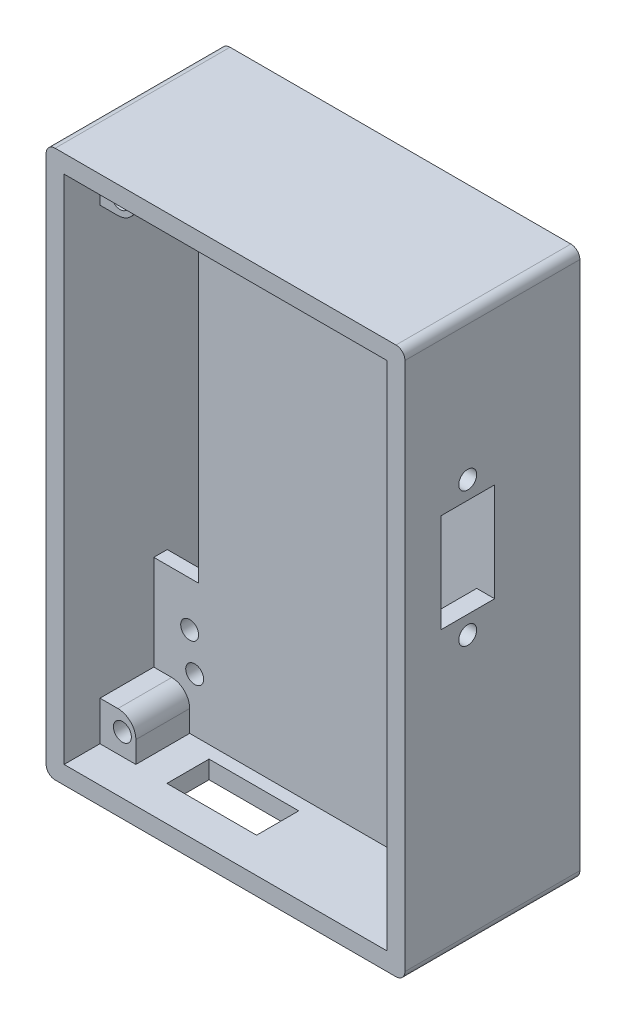
from build123d import *

# Parameters (mm, degrees)
SKETCH_2_R             = 1
EXTRUDE_2250_DEPTH     = 7.5
EXTRUDE_2250_2_DEPTH   = 7.5
EXTRUDE_2250_3_DEPTH   = 7.5
EXTRUDE_2250_4_DEPTH   = 7.5
EXTRUDE_START          = -4.5
SKETCH_2_5_R           = 1
EXTRUDE_2650_DEPTH     = 4.5
EXTRUDE_2650_2_DEPTH   = 4.5
EXTRUDE_2650_3_DEPTH   = 4.5
EXTRUDE_2650_4_DEPTH   = 4.5
EXTRUDE_2769_DEPTH     = 11.5
SKETCH_15_W            = 10
SKETCH_15_H            = 4.7
CUT_EXTRUDE_2936_DEPTH = 2
ESP32_START            = -8
ESP32_DEPTH            = 8
ESP32_3_W              = 10
ESP32_3_H              = 4.7
ESP32_2_DEPTH          = 2
SKETCH_1_29_R          = 1
SKETCH_1_29_W          = 1.5
SKETCH_1_29_H          = 9
EXTRUDE_3195_DEPTH     = 1.5
EXTRUDE_3_DEPTH        = 2.5
SKETCH_1_30_W          = 1.5
SKETCH_1_30_H          = 9
EXTRUDE_3_2_DEPTH      = 2.5
SKETCH_1_31_W          = 1.5
SKETCH_1_31_H          = 9
EXTRUDE_4_DEPTH        = 1.5
SKETCH_18_R            = 1
SKETCH_18_W            = 6
SKETCH_18_H            = 11
CUT_EXTRUDE_4645_DEPTH = 2


with BuildPart() as part:
    # 草图2 → Extrude 2250 (new body)
    with BuildSketch(Plane.XY):
        with BuildLine():
            Line((0, 0), (4, 0))
            Line((4, 0), (4, 2.4))
            ThreePointArc((4, 2.4), (3.414213562, 3.814213562), (2, 4.4))
            Line((2, 4.4), (0, 4.4))
            Line((0, 4.4), (0, 0))
        make_face()
        with Locations((2.5, 2.4)):
            Circle(SKETCH_2_R, mode=Mode.SUBTRACT)
    extrude(amount=EXTRUDE_2250_DEPTH)



with BuildPart() as body_2:
    # 草图2 → Extrude 2250 2 (new body)
    with BuildSketch(Plane.XY):
        with BuildLine():
            Line((36, 0), (32, 0))
            Line((32, 0), (32, 2.4))
            ThreePointArc((32, 2.4), (32.585786438, 3.814213562), (34, 4.4))
            Line((34, 4.4), (36, 4.4))
            Line((36, 4.4), (36, 0))
        make_face()
        with Locations((34, 2.4)):
            Circle(SKETCH_2_R, mode=Mode.SUBTRACT)
    extrude(amount=EXTRUDE_2250_2_DEPTH)


with BuildPart() as body_3:
    # 草图2 → Extrude 2250 3 (new body)
    with BuildSketch(Plane.XY):
        with BuildLine():
            Line((36, 57), (32, 57))
            Line((32, 57), (32, 54))
            ThreePointArc((32, 54), (32.585786438, 52.585786438), (34, 52))
            Line((34, 52), (36, 52))
            Line((36, 52), (36, 57))
        make_face()
        with Locations((33.75, 53.699390835)):
            Circle(SKETCH_2_R, mode=Mode.SUBTRACT)
    extrude(amount=EXTRUDE_2250_3_DEPTH)


with BuildPart() as body_4:
    # 草图2 → Extrude 2250 4 (new body)
    with BuildSketch(Plane.XY):
        with BuildLine():
            Line((0, 57), (4, 57))
            Line((4, 57), (4, 54))
            ThreePointArc((4, 54), (3.414213562, 52.585786438), (2, 52))
            Line((2, 52), (0, 52))
            Line((0, 52), (0, 57))
        make_face()
        with Locations((2.25, 53.699390835)):
            Circle(SKETCH_2_R, mode=Mode.SUBTRACT)
    extrude(amount=EXTRUDE_2250_4_DEPTH)


with BuildPart() as body_5:
    # 草图2<5> → Extrude 2650 (new body)
    with BuildSketch(Plane.XY.offset(EXTRUDE_START)):
        with BuildLine():
            Line((0, 0), (4, 0))
            Line((4, 0), (4, 2.4))
            ThreePointArc((4, 2.4), (3.414213562, 3.814213562), (2, 4.4))
            Line((2, 4.4), (0, 4.4))
            Line((0, 4.4), (0, 0))
        make_face()
        with Locations((2.5, 2.4)):
            Circle(SKETCH_2_5_R, mode=Mode.SUBTRACT)
    extrude(amount=EXTRUDE_2650_DEPTH)


with BuildPart() as body_6:
    # 草图2<5> → Extrude 2650 2 (new body)
    with BuildSketch(Plane.XY.offset(EXTRUDE_START)):
        with BuildLine():
            Line((36, 0), (32, 0))
            Line((32, 0), (32, 2.4))
            ThreePointArc((32, 2.4), (32.585786438, 3.814213562), (34, 4.4))
            Line((34, 4.4), (36, 4.4))
            Line((36, 4.4), (36, 0))
        make_face()
        with Locations((34, 2.4)):
            Circle(SKETCH_2_5_R, mode=Mode.SUBTRACT)
    extrude(amount=EXTRUDE_2650_2_DEPTH)


with BuildPart() as body_7:
    # 草图2<5> → Extrude 2650 3 (new body)
    with BuildSketch(Plane.XY.offset(EXTRUDE_START)):
        with BuildLine():
            Line((36, 57), (32, 57))
            Line((32, 57), (32, 54))
            ThreePointArc((32, 54), (32.585786438, 52.585786438), (34, 52))
            Line((34, 52), (36, 52))
            Line((36, 52), (36, 57))
        make_face()
        with Locations((33.75, 53.699390835)):
            Circle(SKETCH_2_5_R, mode=Mode.SUBTRACT)
    extrude(amount=EXTRUDE_2650_3_DEPTH)


with BuildPart() as body_8:
    # 草图2<5> → Extrude 2650 4 (new body)
    with BuildSketch(Plane.XY.offset(EXTRUDE_START)):
        with BuildLine():
            Line((0, 57), (4, 57))
            Line((4, 57), (4, 54))
            ThreePointArc((4, 54), (3.414213562, 52.585786438), (2, 52))
            Line((2, 52), (0, 52))
            Line((0, 52), (0, 57))
        make_face()
        with Locations((2.25, 53.699390835)):
            Circle(SKETCH_2_5_R, mode=Mode.SUBTRACT)
    extrude(amount=EXTRUDE_2650_4_DEPTH)


with BuildPart() as part_1:
    add(part.part)

    add(body_2.part)  # Extrude 2769 merges body 2

    add(body_3.part)  # Extrude 2769 merges body 3

    add(body_4.part)  # Extrude 2769 merges body 4

    add(body_5.part)  # Extrude 2769 merges body 5

    add(body_6.part)  # Extrude 2769 merges body 6

    add(body_7.part)  # Extrude 2769 merges body 7

    add(body_8.part)  # Extrude 2769 merges body 8
    # 草图1 → Extrude 2769 (add)
    with BuildSketch(Plane.XY):
        with BuildLine():
            ThreePointArc((-2, -1), (-1.707106781, -1.707106781), (-1, -2))
            Line((-1, -2), (37, -2))
            ThreePointArc((37, -2), (37.707106781, -1.707106781), (38, -1))
            Line((38, -1), (38, 58))
            ThreePointArc((38, 58), (37.707106781, 58.707106781), (37, 59))
            Line((37, 59), (-1, 59))
            ThreePointArc((-1, 59), (-1.707106781, 58.707106781), (-2, 58))
            Line((-2, 58), (-2, -1))
        make_face()
        Polygon((36, 0), (0, 0), (0, 15), (0, 51), (0, 57), (36, 57), align=None, mode=Mode.SUBTRACT)
    extrude(amount=EXTRUDE_2769_DEPTH)

    # 草图15 → Cut-Extrude 2936 (cut)
    with BuildSketch(Plane.XZ):
        with Locations((12.56, 5.25)):
            Rectangle(SKETCH_15_W, SKETCH_15_H)
    extrude(amount=CUT_EXTRUDE_2936_DEPTH, mode=Mode.SUBTRACT)

    # 草图1 regions → ESP32 (add)
    with BuildSketch(Plane.XY.offset(ESP32_START)):
        with BuildLine():
            ThreePointArc((-2, -1), (-1.707106781, -1.707106781), (-1, -2))
            Line((-1, -2), (37, -2))
            ThreePointArc((37, -2), (37.707106781, -1.707106781), (38, -1))
            Line((38, -1), (38, 58))
            ThreePointArc((38, 58), (37.707106781, 58.707106781), (37, 59))
            Line((37, 59), (-1, 59))
            ThreePointArc((-1, 59), (-1.707106781, 58.707106781), (-2, 58))
            Line((-2, 58), (-2, -1))
        make_face()
        Polygon((36, 0), (0, 0), (0, 15), (0, 51), (0, 57), (36, 57), align=None, mode=Mode.SUBTRACT)
    extrude(amount=ESP32_DEPTH)

    # ESP32 3 → ESP32 2 (cut)
    with BuildSketch(Plane(origin=(0, 0, 0), x_dir=(1, 0, 0), z_dir=(0, 1, 0))):
        with Locations((17.56, 2.35)):
            Rectangle(ESP32_3_W, ESP32_3_H)
    extrude(amount=-ESP32_2_DEPTH, mode=Mode.SUBTRACT)

    # 草图1<29> → Extrude 3195 (add)
    with BuildSketch(Plane.XY):
        Polygon((0, 15), (0, 0), (36, 0), (36, 57), (0, 57), (0, 51), (5, 51), (5, 15), align=None)
        with Locations((4.56, 6)):
            Circle(SKETCH_1_29_R, mode=Mode.SUBTRACT)
        with Locations((4, 10)):
            Circle(SKETCH_1_29_R, mode=Mode.SUBTRACT)
        with Locations((6.5, 20.5)):
            Rectangle(SKETCH_1_29_W, SKETCH_1_29_H, mode=Mode.SUBTRACT)
        with Locations((30.56, 6)):
            Circle(SKETCH_1_29_R, mode=Mode.SUBTRACT)
        with Locations((31, 10)):
            Circle(SKETCH_1_29_R, mode=Mode.SUBTRACT)
        Polygon((30.25, 16), (28.75, 16), (28.75, 52), (7.25, 52), (7.25, 46), (5.75, 46), (5.75, 53.5), (30.25, 53.5), (30.25, 52), align=None, mode=Mode.SUBTRACT)
    extrude(amount=EXTRUDE_3195_DEPTH)



with BuildPart() as body_2_2:
    # 草图1<30> → 凸台-拉伸3 (new body)
    with BuildSketch(Plane.XY):
        Polygon((5.75, 46), (7.25, 46), (7.25, 52), (28.75, 52), (28.75, 16), (30.25, 16), (30.25, 52), (30.25, 53.5), (5.75, 53.5), align=None)
    extrude(amount=-EXTRUDE_3_DEPTH)


with BuildPart() as body_3_2:
    # 草图1<30> → Extrude 3 2 (new body)
    with BuildSketch(Plane.XY):
        with Locations((6.5, 20.5)):
            Rectangle(SKETCH_1_30_W, SKETCH_1_30_H)
    extrude(amount=-EXTRUDE_3_2_DEPTH)


with BuildPart() as part_2:
    add(part_1.part)

    add(body_2_2.part)  # 凸台-拉伸4 merges body 2 2

    add(body_3_2.part)  # 凸台-拉伸4 merges body 3 2
    # 草图1<31> → 凸台-拉伸4 (add)
    with BuildSketch(Plane.XY):
        Polygon((28.75, 16), (30.25, 16), (30.25, 52), (30.25, 53.5), (5.75, 53.5), (5.75, 46), (7.25, 46), (7.25, 52), (28.75, 52), align=None)
        with Locations((6.5, 20.5)):
            Rectangle(SKETCH_1_31_W, SKETCH_1_31_H)
    extrude(amount=EXTRUDE_4_DEPTH)

    # 草图18 → Cut-Extrude 4645 (cut)
    with BuildSketch(Plane(origin=(38, 0, 0), x_dir=(0, 0, -1), z_dir=(1, 0, 0))):
        with Locations((-4.5, 43)):
            Circle(SKETCH_18_R)
        with Locations((-4.5, 28)):
            Circle(SKETCH_18_R)
        with Locations((-4.5, 35.5)):
            Rectangle(SKETCH_18_W, SKETCH_18_H)
    extrude(amount=-CUT_EXTRUDE_4645_DEPTH, mode=Mode.SUBTRACT)


solid = part_2.part
